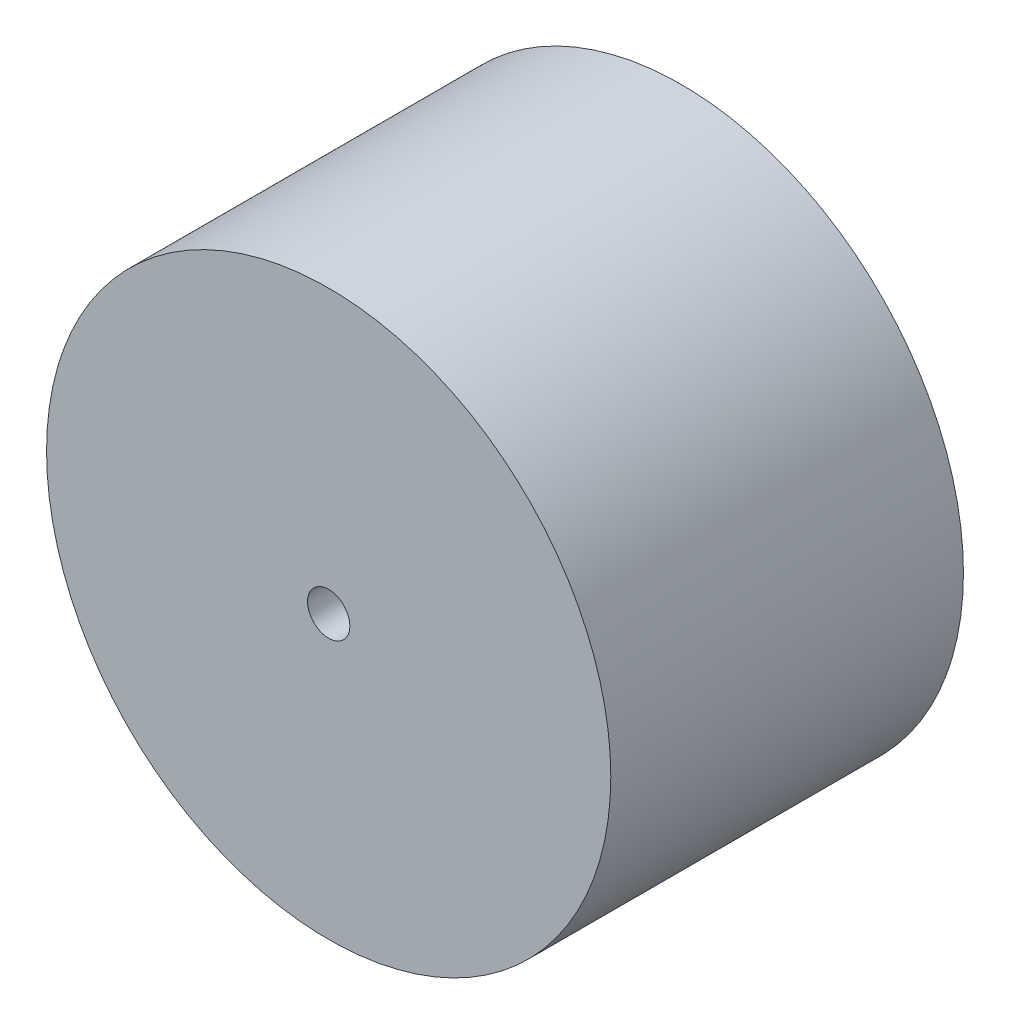
from build123d import *

# Parameters (mm, degrees)
SKETCH_1_R          = 40
EXTRUDE_1_DEPTH     = 50
SKETCH_2_R          = 3
CUT_EXTRUDE_1_DEPTH = 76.498344353


with BuildPart() as part:
    # 草图1 → 凸台-拉伸1 (new body)
    with BuildSketch(Plane.XY):
        Circle(SKETCH_1_R)
    extrude(amount=EXTRUDE_1_DEPTH)

    # 草图2 → 切除-拉伸1 (cut, through all)
    with BuildSketch(Plane.XY.offset(50)):
        Circle(SKETCH_2_R)
    extrude(amount=-CUT_EXTRUDE_1_DEPTH, mode=Mode.SUBTRACT)


solid = part.part
